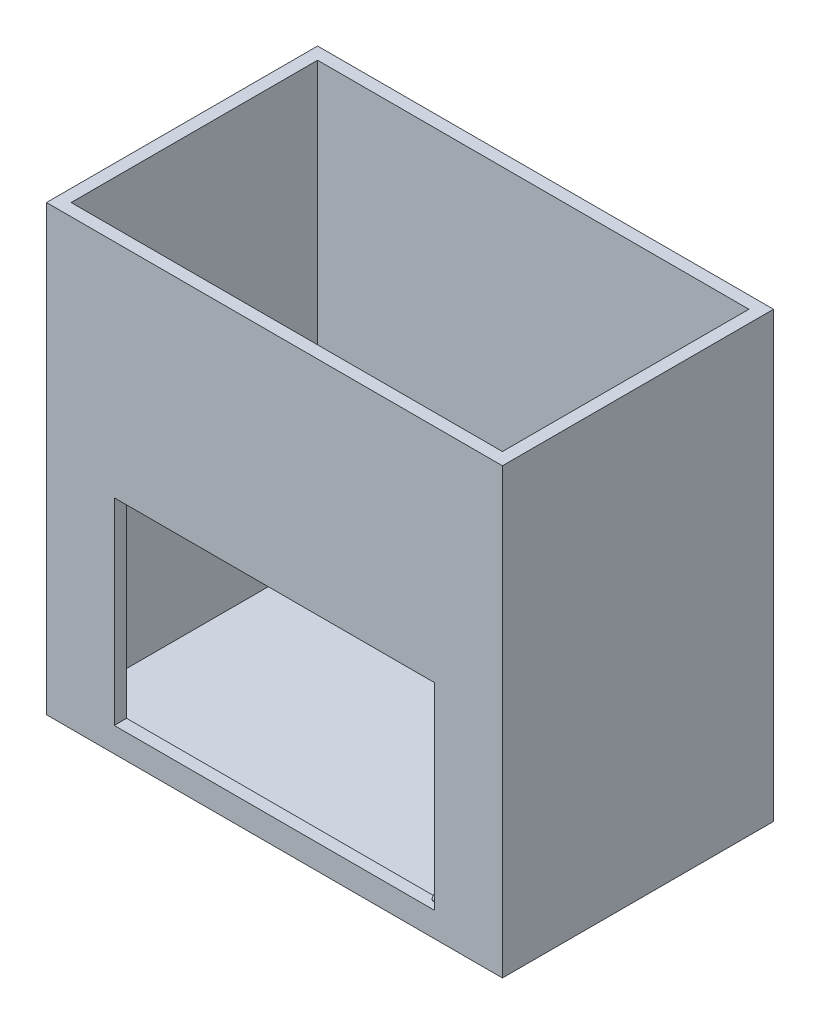
from build123d import *

# Parameters (mm, degrees)
SKETCH1_W           = 185
SKETCH1_H           = 110
SKETCH1_W_2         = 175
SKETCH1_H_2         = 100
EXTRUDE_THIN1_DEPTH = 175
SKETCH2_W           = 185
SKETCH2_H           = 110
BOSS_EXTRUDE2_DEPTH = 5
CUT_EXTRUDE2_REACH  = 228.454
SKETCH5_W           = 130
SKETCH5_H           = 80
SKETCH6_R           = 1.5
BOSS_EXTRUDE3_DEPTH = 2


with BuildPart() as part:
    # Sketch1 → Extrude-Thin1 (new body)
    with BuildSketch(Plane(origin=(0, 0, 0), x_dir=(1, 0, 0), z_dir=(0, 1, 0))):
        Rectangle(SKETCH1_W, SKETCH1_H)
        Rectangle(SKETCH1_W_2, SKETCH1_H_2, mode=Mode.SUBTRACT)
    extrude(amount=EXTRUDE_THIN1_DEPTH)

    # Sketch2 → Boss-Extrude2 (add)
    with BuildSketch(Plane.XZ):
        Rectangle(SKETCH2_W, SKETCH2_H)
    extrude(amount=BOSS_EXTRUDE2_DEPTH)

    # Sketch5 → Cut-Extrude2 (cut, up to next)
    with BuildSketch(Plane.XY.offset(55), mode=Mode.PRIVATE) as cut_extrude2_sk1:
        with Locations((0, 45)):
            Rectangle(SKETCH5_W, SKETCH5_H)
    cut_extrude2_tool1 = extrude(cut_extrude2_sk1.sketch, amount=-CUT_EXTRUDE2_REACH, mode=Mode.PRIVATE) & part.part
    add(cut_extrude2_tool1.solids().sort_by_distance((0, 45, 55))[0], mode=Mode.SUBTRACT)

    # Sketch6 → Boss-Extrude3 (add)
    with BuildSketch(Plane.ZY.offset(-65)):
        with Locations(Location((52.5, 7.5, 0), (0, 0, 270))):
            Circle(SKETCH6_R)
    extrude(amount=BOSS_EXTRUDE3_DEPTH)


solid = part.part
